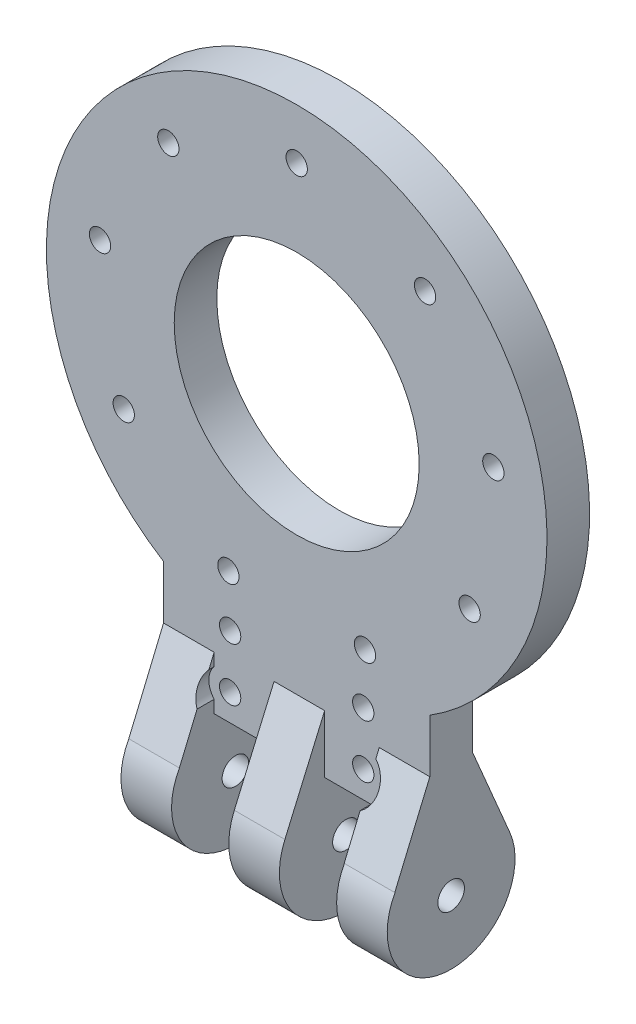
from build123d import *

# Parameters (mm, degrees)
SKETCH_1_R                  = 2
SKETCH_1_R_2                = 23
EXTRUDE_1_DEPTH             = 8
SKETCH_2_R                  = 2.5
EXTRUDE_2_DEPTH             = 9.5
EXTRUDE_START               = -9.5
SKETCH_4_R                  = 2.5
EXTRUDE_4_DEPTH             = 9.5
SKETCH_6_R                  = 12.5
SKETCH_6_R_2                = 2.5
EXTRUDE_1_2_DEPTH           = 4.75
RIB_1_REACH                 = 123.764
SKETCH_7_WALL_W             = 264.861352648
SKETCH_7_WALL_H             = 9.5
EXTRUDE_5_DEPTH             = 9.5
EXTRUDE_6_DEPTH             = 9.5
CUT_EXTRUDE_3_REACH         = 110.864
SKETCH_20_R                 = 4
EXTRUDE_7_REACH             = 111.081
EXTRUDE_7_DIRECTION_2_REACH = 111.081
RIB_2_REACH                 = 123.764
SKETCH_14_WALL_W            = 263.59041227
SKETCH_14_WALL_H            = 9.5
RIB_3_REACH                 = 111.081
SKETCH_26_WALL_W            = 238.931348054
SKETCH_26_WALL_H            = 9.5


with BuildPart() as part:
    # 草图1 → Extrude 1 (new body)
    with BuildSketch(Plane.XY):
        with BuildLine():
            Line((-25, -10), (25, -10))
            Line((25, -10), (25, 10))
            ThreePointArc((25, 10), (0, 96.799497484), (-25, 10))
            Line((-25, 10), (-25, -10))
        make_face()
        with Locations((24.104535363, 78.526164101)):
            Circle(SKETCH_1_R, mode=Mode.SUBTRACT)
        with Locations((36.930290738, 56.311304147)):
            Circle(SKETCH_1_R, mode=Mode.SUBTRACT)
        with Locations((32.475952642, 31.049497484)):
            Circle(SKETCH_1_R, mode=Mode.SUBTRACT)
        with Locations((12.825755375, 14.561024205)):
            Circle(SKETCH_1_R, mode=Mode.SUBTRACT)
        with Locations((-12.825755375, 14.561024205)):
            Circle(SKETCH_1_R, mode=Mode.SUBTRACT)
        with Locations((-32.475952642, 31.049497484)):
            Circle(SKETCH_1_R, mode=Mode.SUBTRACT)
        with Locations((-36.930290738, 56.311304147)):
            Circle(SKETCH_1_R, mode=Mode.SUBTRACT)
        with Locations((-24.104535363, 78.526164101)):
            Circle(SKETCH_1_R, mode=Mode.SUBTRACT)
        with Locations((0, 87.299497484)):
            Circle(SKETCH_1_R, mode=Mode.SUBTRACT)
        with Locations((12.5, -5)):
            Circle(SKETCH_1_R, mode=Mode.SUBTRACT)
        with Locations(Location((-12.5, -5, 0), (0, 0, 180))):
            Circle(SKETCH_1_R, mode=Mode.SUBTRACT)
        with Locations((12.5, 5)):
            Circle(SKETCH_1_R, mode=Mode.SUBTRACT)
        with Locations(Location((-12.5, 5, 0), (0, 0, 180))):
            Circle(SKETCH_1_R, mode=Mode.SUBTRACT)
        with Locations((0, 49.799497484)):
            Circle(SKETCH_1_R_2, mode=Mode.SUBTRACT)
    extrude(amount=EXTRUDE_1_DEPTH)

    # 草图2 → 凸台-拉伸2 (add)
    with BuildSketch(Plane.ZY.offset(25)):
        with BuildLine():
            ThreePointArc((0, -10), (4, -33.313708499), (8, -10))
            Line((8, -10), (0, -10))
        make_face()
        with Locations((4, -21.313708499)):
            Circle(SKETCH_2_R, mode=Mode.SUBTRACT)
    extrude(amount=-EXTRUDE_2_DEPTH)

    # 草图4 → 凸台-拉伸4 (add)
    with BuildSketch(Plane(origin=(25, 0, 0), x_dir=(0, 0, -1), z_dir=(1, 0, 0)).offset(EXTRUDE_START)):
        with BuildLine():
            Line((-8, -10), (0, -10))
            ThreePointArc((0, -10), (-4, -33.313708499), (-8, -10))
        make_face()
        with Locations(Location((-4, -21.313708499, 0), (0, 0, 180))):
            Circle(SKETCH_4_R, mode=Mode.SUBTRACT)
    extrude(amount=EXTRUDE_4_DEPTH)

    # 草图6 → Extrude 1 2 (add, symmetric)
    with BuildSketch(Plane.ZY.offset(-0.5)):
        with Locations((4, -21.313708499)):
            Circle(SKETCH_6_R)
        with Locations((4, -21.313708499)):
            Circle(SKETCH_6_R_2, mode=Mode.SUBTRACT)
    extrude(amount=EXTRUDE_1_2_DEPTH, both=True)

    # 草图7 wall → 筋1 (add, up to next)
    with BuildSketch(Plane(origin=(-25, -8.913712594, 11.741206943), x_dir=(0, -0.922076341467, 0.387008036747), z_dir=(0, 0.387008036747, 0.922076341467)), mode=Mode.PRIVATE) as rib_1_sk1:
        with Locations((0, 4.75)):
            Rectangle(SKETCH_7_WALL_W, SKETCH_7_WALL_H)
    rib_1_tool1 = extrude(rib_1_sk1.sketch, amount=-RIB_1_REACH, mode=Mode.PRIVATE) - part.part
    add(rib_1_tool1.solids().sort_by_distance((-25, -8.913712594, 11.741206943))[0])

    # 草图12 → 凸台-拉伸5 (add)
    with BuildSketch(Plane(origin=(25, 0, 0), x_dir=(0, 0, -1), z_dir=(1, 0, 0))):
        Polygon((-8, 0), (-14.585289986, -15.537763557), (-9.647107703, -16.867490218), (-3.376423307, -1.94259218), align=None)
    extrude(amount=-EXTRUDE_5_DEPTH)

    # 草图15 → 凸台-拉伸6 (add)
    with BuildSketch(Plane.ZY.offset(25)):
        Polygon((0, 0), (-7.048639525, -16.631020739), (-1.081318286, -18.151978355), (5.605109172, -2.375584437), align=None)
    extrude(amount=-EXTRUDE_6_DEPTH)

    # 切除-拉伸3: up to this plane
    cut_extrude_3_end = Plane(origin=(-4.752183054, 0, 8), z_dir=(0, 0.390223979972796, 0.9207199603865396))
    # 草图20 → 切除-拉伸3 (cut, up to the surface)
    with BuildSketch(Plane.XY.offset(8), mode=Mode.PRIVATE) as cut_extrude_3_sk1:
        with Locations((-12.5, -5)):
            Circle(SKETCH_20_R)
    cut_extrude_3_tool1 = split(extrude(cut_extrude_3_sk1.sketch, amount=CUT_EXTRUDE_3_REACH, mode=Mode.PRIVATE), bisect_by=cut_extrude_3_end, keep=Keep.BOTH, mode=Mode.PRIVATE)
    add(cut_extrude_3_tool1.solids().sort_by_distance((-12.5, -5, 8))[0], mode=Mode.SUBTRACT)
    # 草图20 → 切除-拉伸3 (cut, up to the surface)
    with BuildSketch(Plane.XY.offset(8), mode=Mode.PRIVATE) as cut_extrude_3_sk2:
        with Locations((13.5, -5)):
            Circle(SKETCH_20_R)
    cut_extrude_3_tool2 = split(extrude(cut_extrude_3_sk2.sketch, amount=CUT_EXTRUDE_3_REACH, mode=Mode.PRIVATE), bisect_by=cut_extrude_3_end, keep=Keep.BOTH, mode=Mode.PRIVATE)
    add(cut_extrude_3_tool2.solids().sort_by_distance((13.5, -5, 8))[0], mode=Mode.SUBTRACT)

    # 凸台-拉伸7: up to this face of the body (flat: up to its plane)
    extrude_7_end = Plane(part.part.faces().sort_by_distance((-4.25, -9.735494608, -0.348936668))[0])
    # 草图23 → 凸台-拉伸7 (add, up to the picked face)
    with BuildSketch(Plane.ZY.offset(-0.5), mode=Mode.PRIVATE) as extrude_7_sk1:
        Polygon((3.246577314, -1.407985537), (-0.12612028, -0.27585848), (-7.368219852, -16.116249756), (-3.841621723, -16.91175555), align=None)
    extrude_7_tool1 = split(extrude(extrude_7_sk1.sketch, amount=EXTRUDE_7_REACH, mode=Mode.PRIVATE), bisect_by=extrude_7_end, keep=Keep.BOTH, mode=Mode.PRIVATE)
    add(extrude_7_tool1.solids().sort_by(Axis((0.5, -8.676237, -2.028521), (-1, 0, 0)))[0])

    # 凸台-拉伸7 direction 2: up to this face of the body (flat: up to its plane)
    extrude_7_direction_2_end = Plane(part.part.faces().sort_by_distance((5.25, -9.735494608, -0.348936668))[0])
    # 草图23 → 凸台-拉伸7 direction 2 (add, up to the picked face)
    with BuildSketch(Plane.ZY.offset(-0.5), mode=Mode.PRIVATE) as extrude_7_direction_2_sk1:
        Polygon((3.246577314, -1.407985537), (-0.12612028, -0.27585848), (-7.368219852, -16.116249756), (-3.841621723, -16.91175555), align=None)
    extrude_7_direction_2_tool1 = split(extrude(extrude_7_direction_2_sk1.sketch, amount=-EXTRUDE_7_DIRECTION_2_REACH, mode=Mode.PRIVATE), bisect_by=extrude_7_direction_2_end, keep=Keep.BOTH, mode=Mode.PRIVATE)
    add(extrude_7_direction_2_tool1.solids().sort_by(Axis((0.5, -8.676237, -2.028521), (1, 0, 0)))[0])

    # 草图14 wall → 筋2 (add, up to next)
    with BuildSketch(Plane(origin=(25, -8.31551037, -3.524319762), x_dir=(0, -0.920719960377, -0.390223979996), z_dir=(0, 0.390223979996, -0.920719960377)), mode=Mode.PRIVATE) as rib_2_sk1:
        with Locations((0, 4.75)):
            Rectangle(SKETCH_14_WALL_W, SKETCH_14_WALL_H)
    rib_2_tool1 = extrude(rib_2_sk1.sketch, amount=-RIB_2_REACH, mode=Mode.PRIVATE) - part.part
    add(rib_2_tool1.solids().sort_by_distance((25, -8.31551037, -3.524319762))[0])

    # 草图26 wall → 筋3 (add, up to next)
    with BuildSketch(Plane(origin=(0.5, -7.730285811, 11.733990841), x_dir=(0, -0.917438534624, 0.397877537927), z_dir=(0, 0.397877537927, 0.917438534624)), mode=Mode.PRIVATE) as rib_3_sk1:
        Rectangle(SKETCH_26_WALL_W, SKETCH_26_WALL_H)
    rib_3_tool1 = extrude(rib_3_sk1.sketch, amount=-RIB_3_REACH, mode=Mode.PRIVATE) - part.part
    add(rib_3_tool1.solids().sort_by_distance((0.5, -7.730285811, 11.733990841))[0])


solid = part.part
